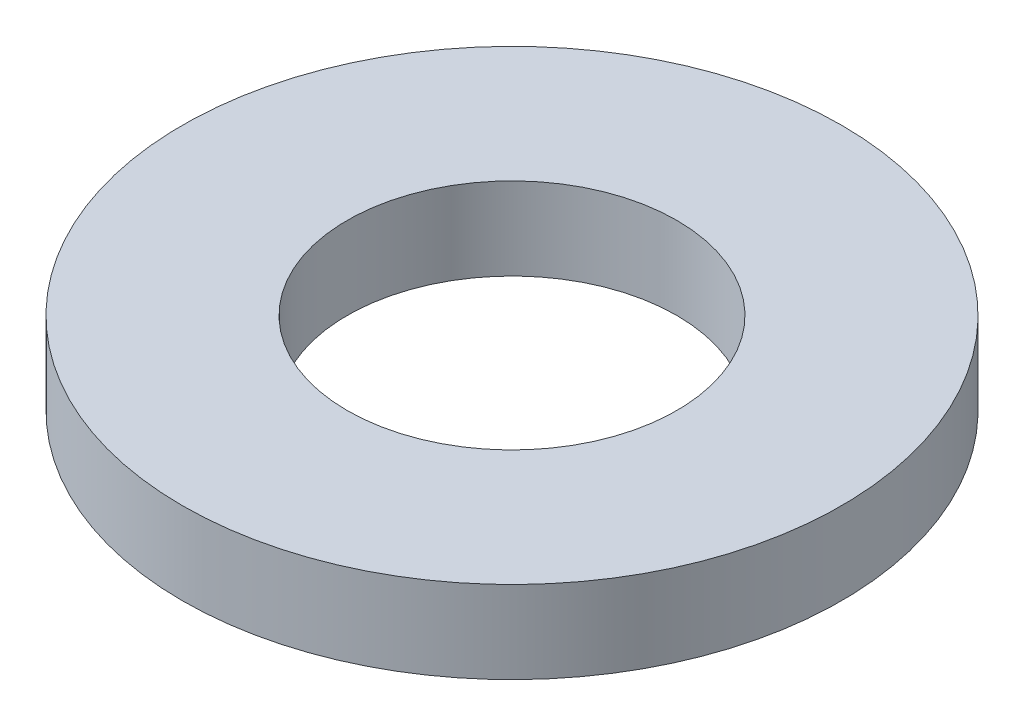
from build123d import *

# Parameters (mm, degrees)
SKIZZE1_W = 4
SKIZZE1_H = 2


with BuildPart() as part:
    # Skizze1 → Rotation1 (revolve)
    with BuildSketch(Plane.XY, mode=Mode.PRIVATE) as rotation1_sk:
        with Locations((6, 1)):
            Rectangle(SKIZZE1_W, SKIZZE1_H)
    revolve(rotation1_sk.sketch.rotate(Axis((0, 2, 0), (0, -1, 0)), 270), axis=Axis((0, 2, 0), (0, -1, 0)))


solid = part.part
